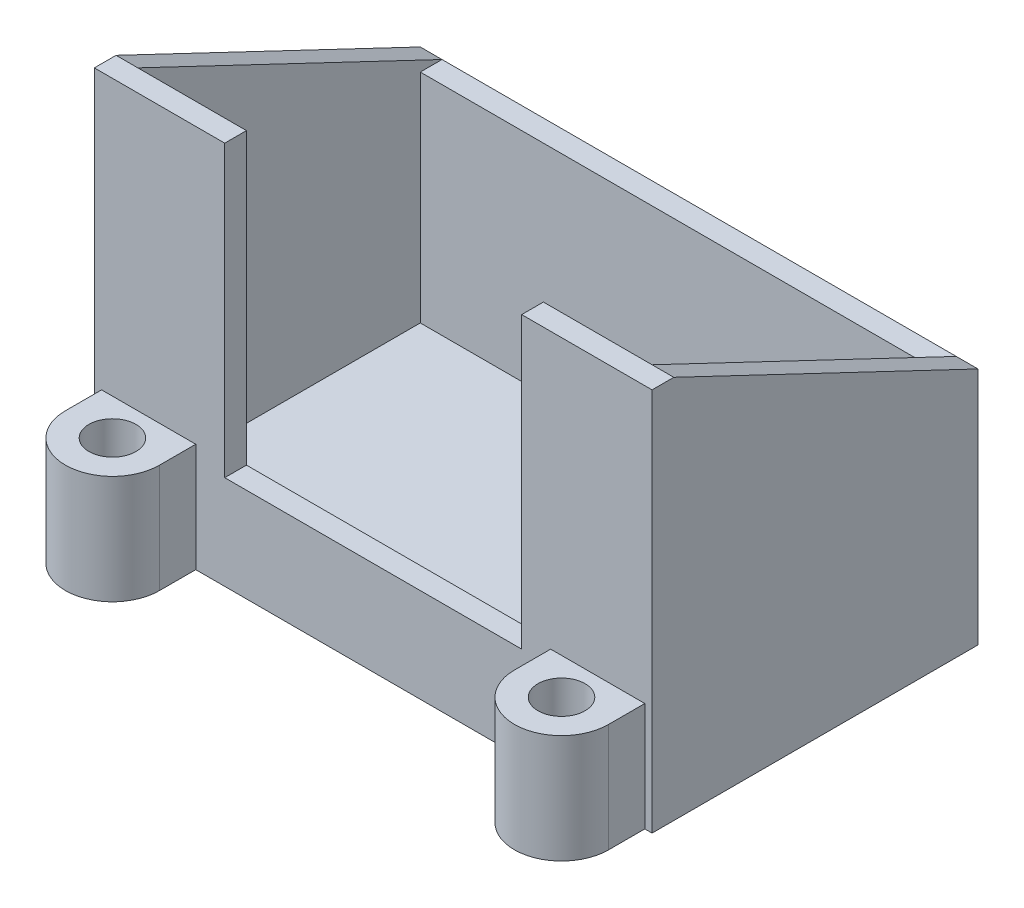
from build123d import *

# Parameters (mm, degrees)
SKETCH_1_W          = 77
SKETCH_1_H          = 45
EXTRUDE_1_DEPTH     = 33
CUT_EXTRUDE_1_DEPTH = 30
SKETCH_5_W          = 18
SKETCH_5_H          = 3
EXTRUDE_3_DEPTH     = 20
EXTRUDE_4_DEPTH     = 3
SKETCH_8_W          = 41
SKETCH_8_H          = 3
EXTRUDE_6_DEPTH     = 10
SKETCH_4_R          = 3.25
EXTRUDE_2_DEPTH     = 15


with BuildPart() as part:
    # 草图1 → 凸台-拉伸1 (new body)
    with BuildSketch(Plane(origin=(0, 0, 0), x_dir=(1, 0, 0), z_dir=(0, 1, 0))):
        Rectangle(SKETCH_1_W, SKETCH_1_H)
    extrude(amount=EXTRUDE_1_DEPTH)

    # 草图2 → 切除-拉伸1 (cut)
    with BuildSketch(Plane(origin=(0, 33, 0), x_dir=(1, 0, 0), z_dir=(0, 1, 0))):
        Polygon((35.5, -19.5), (35.5, 19.5), (-35.5, 19.5), (-35.5, -19.5), (-20.5, -19.5), (-20.5, -22.5), (20.5, -22.5), (20.5, -19.5), align=None)
    extrude(amount=-CUT_EXTRUDE_1_DEPTH, mode=Mode.SUBTRACT)

    # 草图5 → 凸台-拉伸3 (add)
    with BuildSketch(Plane(origin=(0, 33, 0), x_dir=(1, 0, 0), z_dir=(0, 1, 0))):
        with Locations((-29.5, -21)):
            Rectangle(SKETCH_5_W, SKETCH_5_H)
        with Locations((29.5, -21)):
            Rectangle(SKETCH_5_W, SKETCH_5_H)
    extrude(amount=EXTRUDE_3_DEPTH)

    # 草图7 → 凸台-拉伸4 (add)
    with BuildSketch(Plane(origin=(38.5, 0, 0), x_dir=(0, 0, -1), z_dir=(1, 0, 0))):
        Polygon((22.5, 33), (-19.5, 33), (-19.5, 53), align=None)
    extrude_4 = extrude(amount=-EXTRUDE_4_DEPTH)

    # 镜向1: 凸台-拉伸4 across plane
    add(extrude_4.mirror(Plane(origin=(0, 0, 0), x_dir=(0, 0, 1), z_dir=(1, 0, 0))))

    # 草图8 → 凸台-拉伸6 (add)
    with BuildSketch(Plane(origin=(0, 3, 0), x_dir=(1, 0, 0), z_dir=(0, 1, 0))):
        with Locations((0, -21)):
            Rectangle(SKETCH_8_W, SKETCH_8_H)
    extrude(amount=EXTRUDE_6_DEPTH)

    # 草图4 → 凸台-拉伸2 (add)
    # profile 1 of 2: a face of its own
    with BuildSketch(Plane(origin=(0, 0, 0), x_dir=(1, 0, 0), z_dir=(0, 1, 0))):
        with BuildLine():
            Line((-37.5, -27.5), (-37.5, -22.5))
            Line((-37.5, -22.5), (-24.5, -22.5))
            Line((-24.5, -22.5), (-24.5, -27.5))
            ThreePointArc((-24.5, -27.5), (-31, -34), (-37.5, -27.5))
        make_face()
        with Locations(Location((-31, -27.5, 0), (0, 0, 270))):
            Circle(SKETCH_4_R, mode=Mode.SUBTRACT)
    # profile 2 of 2: a face of its own
    with BuildSketch(Plane(origin=(0, 0, 0), x_dir=(1, 0, 0), z_dir=(0, 1, 0))):
        with BuildLine():
            Line((37.5, -27.5), (37.5, -22.5))
            Line((37.5, -22.5), (24.5, -22.5))
            Line((24.5, -22.5), (24.5, -27.5))
            ThreePointArc((24.5, -27.5), (31, -34), (37.5, -27.5))
        make_face()
        with Locations(Location((31, -27.5, 0), (0, 0, 270))):
            Circle(SKETCH_4_R, mode=Mode.SUBTRACT)
    extrude(amount=EXTRUDE_2_DEPTH)


solid = part.part
